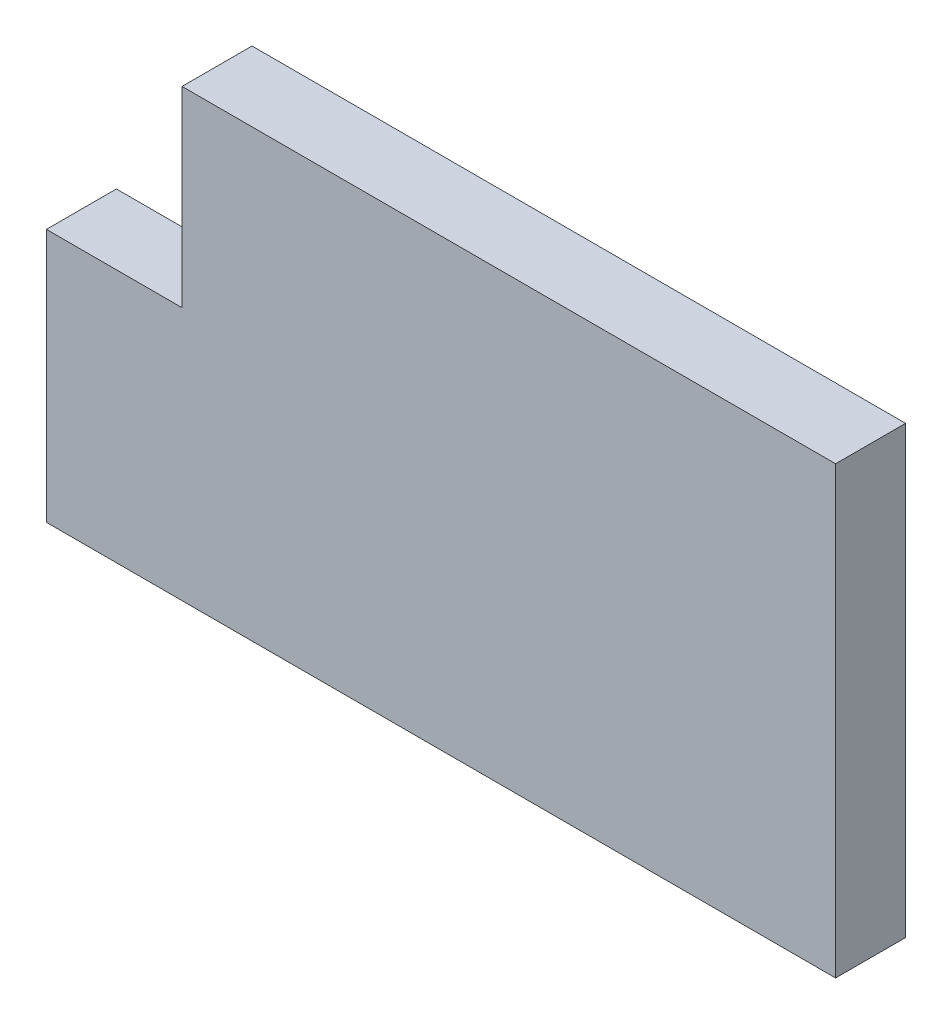
from build123d import *

# Parameters (mm, degrees)
EXTRUDE_1_DEPTH = 800


with BuildPart() as part:
    # Эскиз1 → Бобышка-Вытянуть1 (new body)
    with BuildSketch(Plane.XY):
        Polygon((906.35402749, 2129.285994672), (7776.35402749, 2129.285994672), (8076.35402749, 2129.285994672), (8076.35402749, -2660.714005328), (8076.35402749, -2960.714005328), (-643.64597251, -2960.714005328), (-943.64597251, -2960.714005328), (-943.64597251, -360.714005328), (-943.64597251, -60.714005328), (606.35402749, -60.714005328), (606.35402749, 2129.285994672), align=None)
    extrude(amount=EXTRUDE_1_DEPTH)


solid = part.part
